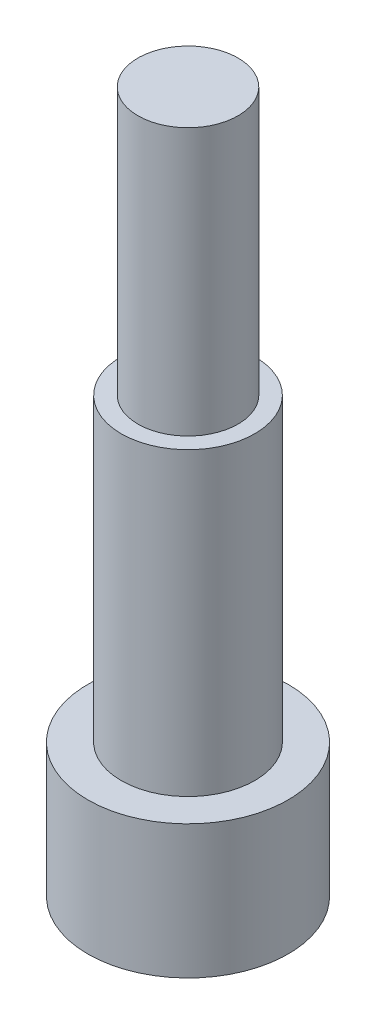
from build123d import *

# Parameters (mm, degrees)
CUT_EXTRUDE1_DEPTH = 2


with BuildPart() as part:
    # Sketch1 → Revolve1 (revolve)
    with BuildSketch(Plane.XY, mode=Mode.PRIVATE) as revolve1_sk:
        Polygon((0, 0), (3, 0), (3, 4), (2, 4), (2, 13), (1.5, 13), (1.5, 21), (0, 21), align=None)
    revolve(revolve1_sk.sketch.rotate(Axis((0, 21, 0), (0, -1, 0)), 90), axis=Axis((0, 21, 0), (0, -1, 0)))

    # Sketch2 → Cut-Extrude1 (cut)
    with BuildSketch(Plane.XZ):
        Polygon((0, -1.732050808), (1.5, -0.866025404), (1.5, 0.866025404), (0, 1.732050808), (-1.5, 0.866025404), (-1.5, -0.866025404), align=None)
    extrude(amount=-CUT_EXTRUDE1_DEPTH, mode=Mode.SUBTRACT)


solid = part.part
